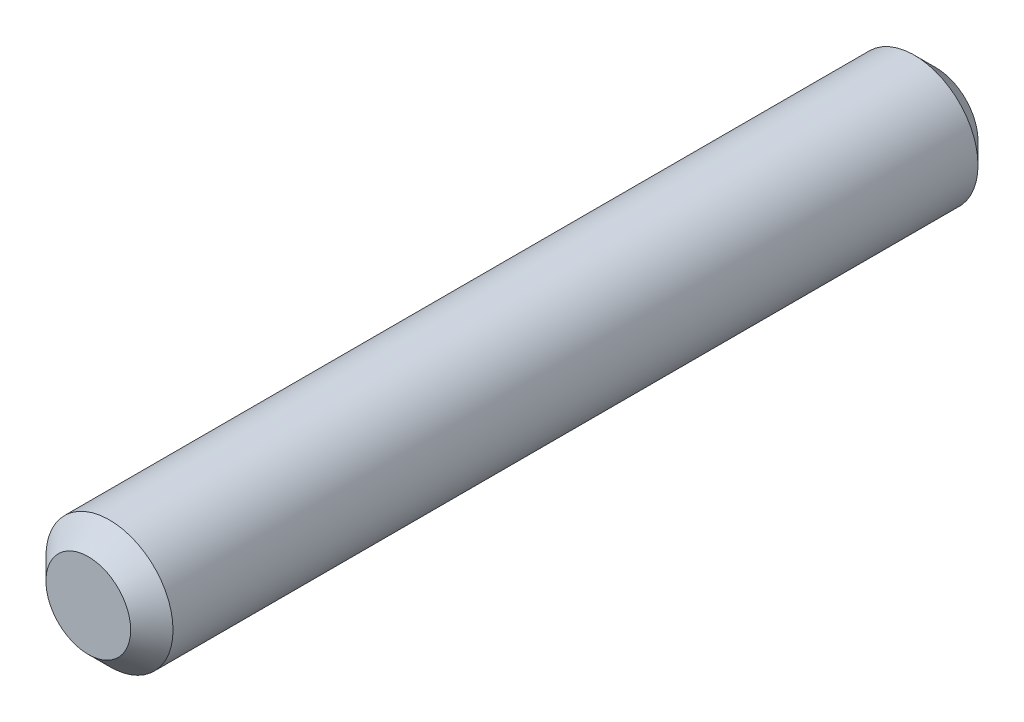
from build123d import *

# Parameters (mm, degrees)
SKETCH_1_R      = 3
EXTRUDE_1_DEPTH = 20
CHAMFER_1_SIZE  = 1


with BuildPart() as part:
    # 草图1 → 凸台-拉伸1 (new, symmetric)
    with BuildSketch(Plane.XY):
        Circle(SKETCH_1_R)
    extrude(amount=EXTRUDE_1_DEPTH, both=True)

    # 倒角1
    chamfer_1_edges = [part.edges().sort_by_distance(p)[0] for p in [
        (-3, 0, -20),
        (-3, 0, 20),
    ]]
    chamfer(chamfer_1_edges, length=CHAMFER_1_SIZE)


solid = part.part
